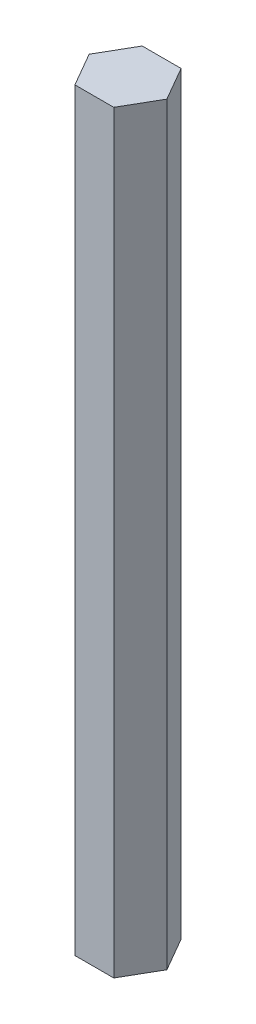
from build123d import *

# Parameters (mm, degrees)
BOSS_EXTRUDE1_DEPTH = 142.24


with BuildPart() as part:
    # Sketch1 → Boss-Extrude1 (new body)
    with BuildSketch(Plane(origin=(0, 0, 0), x_dir=(1, 0, 0), z_dir=(0, 1, 0))):
        Polygon((-7.332348419, 0), (-3.666174209, -6.35), (3.666174209, -6.35), (7.332348419, 0), (3.666174209, 6.35), (-3.666174209, 6.35), align=None)
    extrude(amount=BOSS_EXTRUDE1_DEPTH)


solid = part.part
